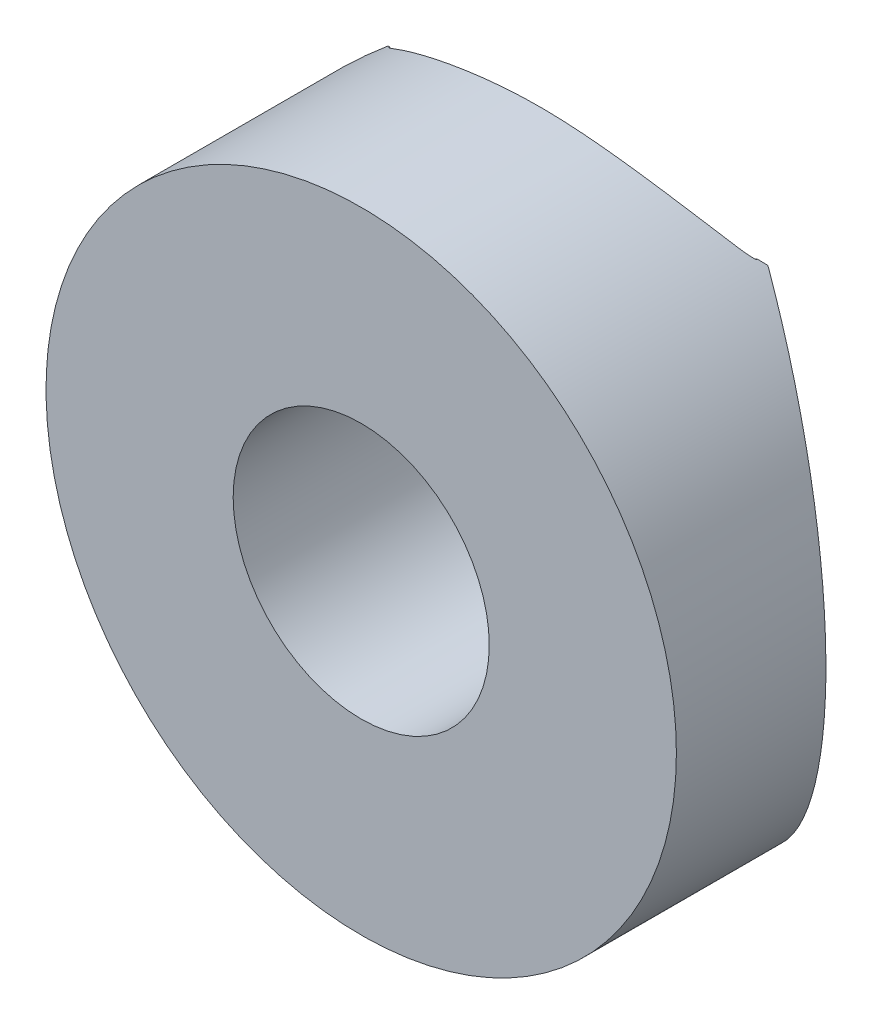
from build123d import *

# Parameters (mm, degrees)
CROQUIS1_R                 = 8
CROQUIS1_R_2               = 3.25
SALIENTE_EXTRUIR1_DEPTH    = 5.5
CORTAR_EXTRUIR1_START      = -3.2
CROQUIS3_R                 = 8.2
CORTAR_EXTRUIR1_DEPTH      = 3.4
CORTAR_EXTRUIR2_DEPTH      = 3.4
CORTAR_EXTRUIR3_REACH      = 16.898
CROQUIS5_R                 = 9
CORTAR_EXTRUIR4_DEPTH      = 13.579745796
CORTAR_EXTRUIR4_DEPTH_BACK = 13.579745796


with BuildPart() as part:
    # Croquis1 → Saliente-Extruir1 (new body)
    with BuildSketch(Plane.XY):
        Circle(CROQUIS1_R)
        Circle(CROQUIS1_R_2, mode=Mode.SUBTRACT)
    extrude(amount=SALIENTE_EXTRUIR1_DEPTH)

    # Croquis3 → Cortar-Extruir1 (cut)
    with BuildSketch(Plane(origin=(0, 6.5, 0), x_dir=(1, 0, 0), z_dir=(0, 1, 0)).offset(CORTAR_EXTRUIR1_START)):
        with Locations((0, 6.632138172)):
            Circle(CROQUIS3_R)
    cortar_extruir1 = extrude(amount=CORTAR_EXTRUIR1_DEPTH, mode=Mode.SUBTRACT)

    # Croquis4 → Cortar-Extruir2 (cut)
    with BuildSketch(Plane(origin=(0, 6.5, 0), x_dir=(1, 0, 0), z_dir=(0, 1, 0))):
        with BuildLine():
            Line((-4.82231721, 1.547107411), (4.82231721, 1.547107411))
            add(Edge.make_bspline(
                [(4.371498599, -0.305440656), (5.098983206, 0.005932333), (5.249256077, 0.623448355), (4.82231721, 1.547107411)],
                knots=[0, 0, 0, 0, 1, 1, 1, 1], degree=3))
            add(Edge.make_bspline(
                [(-4.371498599, -0.305440656), (-2.961142952, -0.90909144), (-0.0365681, -1.156703774), (3.034279152, -0.877788184), (4.371498599, -0.305440656)],
                knots=[0, 0, 0, 0, 0.5, 1, 1, 1, 1], degree=3))
            add(Edge.make_bspline(
                [(-4.371498599, -0.305440656), (-5.098983206, 0.005932333), (-5.249256077, 0.623448355), (-4.82231721, 1.547107411)],
                knots=[0, 0, 0, 0, 1, 1, 1, 1], degree=3))
        make_face()
    cortar_extruir2 = extrude(amount=CORTAR_EXTRUIR2_DEPTH, mode=Mode.SUBTRACT)

    # Simetría1: Cortar-Extruir1, Cortar-Extruir2 across plane
    add(cortar_extruir1.mirror(Plane.ZX), mode=Mode.SUBTRACT)
    add(cortar_extruir2.mirror(Plane.ZX), mode=Mode.SUBTRACT)

    # Cortar-Extruir3: up to this face of the body (flat: up to its plane)
    cortar_extruir3_end = Plane(part.part.faces().sort_by_distance((0, -3.3, 0.632585689))[0])
    # Croquis5 → Cortar-Extruir3 (cut, up to the picked face)
    with BuildSketch(Plane(origin=(0, 3.3, 0), x_dir=(1, 0, 0), z_dir=(0, 1, 0)), mode=Mode.PRIVATE) as cortar_extruir3_sk1:
        with Locations((0, 8.105012001)):
            Circle(CROQUIS5_R)
    cortar_extruir3_tool1 = split(extrude(cortar_extruir3_sk1.sketch, amount=-CORTAR_EXTRUIR3_REACH, mode=Mode.PRIVATE), bisect_by=cortar_extruir3_end, keep=Keep.BOTH, mode=Mode.PRIVATE)
    add(cortar_extruir3_tool1.solids().sort_by(Axis((0, 3.3, -8.105012), (0, -1, 0)))[0], mode=Mode.SUBTRACT)

    # Croquis6 → Cortar-Extruir4 (cut, two sides: drawn at the far end of the back side and taken through both)
    with BuildSketch(Plane(origin=(0, 0, 0), x_dir=(1, 0, 0), z_dir=(0, 1, 0)).offset(-CORTAR_EXTRUIR4_DEPTH_BACK)):
        Polygon((-4.82231721, 0), (-8.482103493, -1.964045705), (-8.482103493, 2.868930537), (8.482103493, 2.868930537), (8.482103493, -1.964045705), (4.82231721, 0), (4.82231721, 1.250339437), (-4.82231721, 1.250339437), align=None)
    extrude(amount=CORTAR_EXTRUIR4_DEPTH + CORTAR_EXTRUIR4_DEPTH_BACK, mode=Mode.SUBTRACT)


solid = part.part
